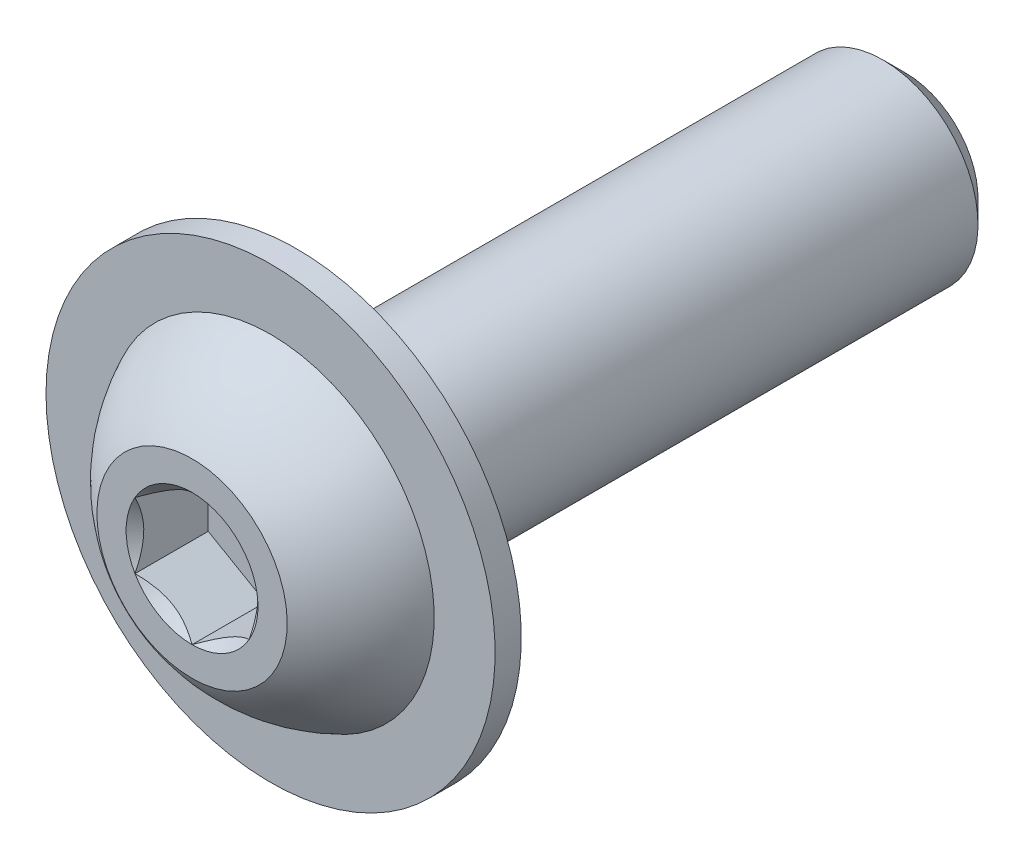
from build123d import *

# Parameters (mm, degrees)
SKETCH1_W           = 16
SKETCH1_H           = 2.5
CHAMFER1_SIZE       = 0.6
SKETCH11_R          = 5.9
BOSS_EXTRUDE3_DEPTH = 0.6875
CUT_EXTRUDE2_DEPTH  = 1.925


with BuildPart() as part:
    # Sketch1 → Revolve1 (revolve)
    with BuildSketch(Plane(origin=(0, 0, 0), x_dir=(0, 0, -1), z_dir=(1, 0, 0))):
        with Locations((10.75, 1.25)):
            Rectangle(SKETCH1_W, SKETCH1_H)
    revolve(axis=Axis((0, 0, -18.75), (0, 0, 1)))

    # Chamfer1
    chamfer1_edges = [part.edges().sort_by_distance(p)[0] for p in [
        (0, -2.5, -18.75),
    ]]
    chamfer(chamfer1_edges, length=CHAMFER1_SIZE)

    # Sketch7 → Revolve2 (revolve)
    with BuildSketch(Plane(origin=(0, 0, 0), x_dir=(0, 0, -1), z_dir=(1, 0, 0)), mode=Mode.PRIVATE) as revolve2_sk:
        with BuildLine():
            Line((2.0625, 4.3), (2.75, 4.3))
            Line((2.75, 4.3), (2.75, 0))
            Line((2.75, 0), (0, 0))
            Line((0, 0), (0, 2.5))
            ThreePointArc((0, 2.5), (0.897763556, 3.552953217), (2.0625, 4.3))
        make_face()
    revolve(revolve2_sk.sketch.rotate(Axis((0, 0, 0), (0, 0, -1)), 180), axis=Axis((0, 0, 0), (0, 0, -1)))

    # Sketch11 → Boss-Extrude3 (add)
    with BuildSketch(Plane(origin=(0, 0, -2.75), x_dir=(-1, 0, 0), z_dir=(0, 0, -1))):
        Circle(SKETCH11_R)
    extrude(amount=-BOSS_EXTRUDE3_DEPTH)

    # Sketch5 → Cut-Extrude2 (cut)
    with BuildSketch(Plane.XY):
        Polygon((1.5, -0.866025404), (1.5, 0.866025404), (0, 1.732050808), (-1.5, 0.866025404), (-1.5, -0.866025404), (0, -1.732050808), align=None)
    extrude(amount=-CUT_EXTRUDE2_DEPTH, mode=Mode.SUBTRACT)

    # Cut-Extrude3 cone 1 section (through the dimple's axis) → Cut-Extrude3 (revolve, cut)
    with BuildSketch(Plane(origin=(0, 0, 0), x_dir=(0, -1, 0), z_dir=(1, 0, 0))):
        Polygon((0, 0), (1.732050808, 0), (0, 1.732050808), align=None)
    revolve(axis=Axis((0, 0, 0), (0, 0, -1)), mode=Mode.SUBTRACT)


solid = part.part
